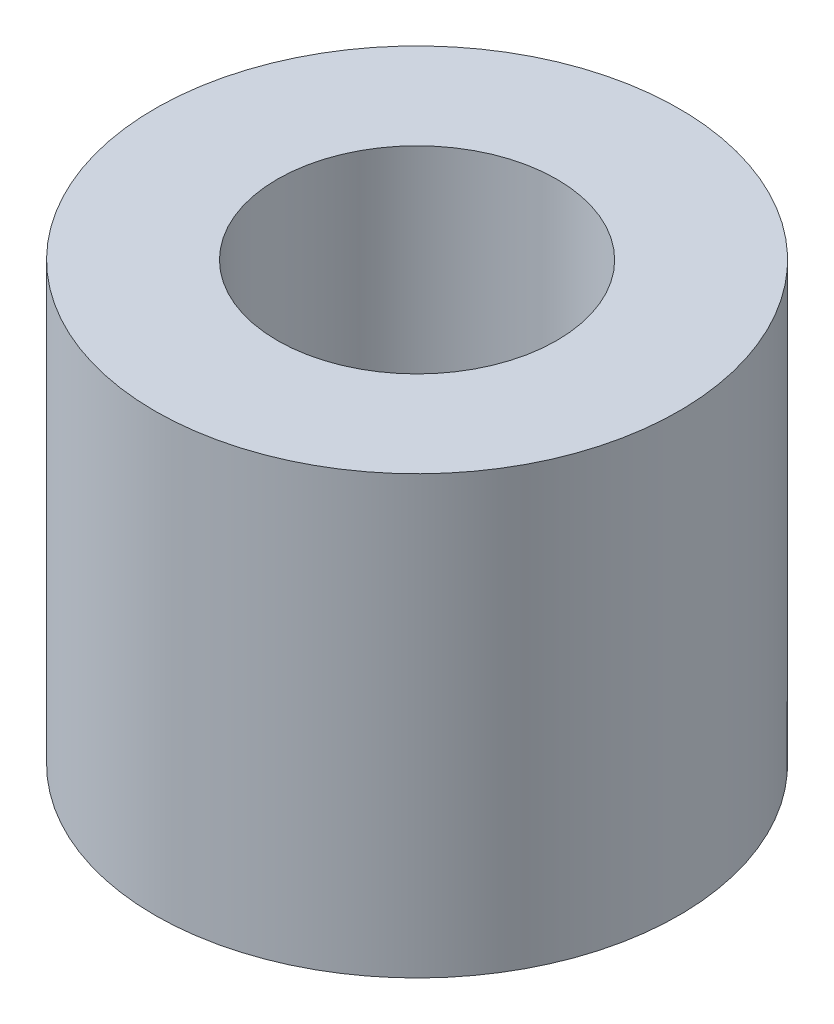
from build123d import *

# Parameters (mm, degrees)
SKETCH1_R           = 3
SKETCH1_R_2         = 1.6
BOSS_EXTRUDE1_DEPTH = 5


with BuildPart() as part:
    # Sketch1 → Boss-Extrude1 (new body)
    with BuildSketch(Plane(origin=(0, 0, 0), x_dir=(1, 0, 0), z_dir=(0, 1, 0))):
        with Locations(Location((0, 0, 0), (0, 0, 270))):
            Circle(SKETCH1_R)
        with Locations(Location((0, 0, 0), (0, 0, 270))):
            Circle(SKETCH1_R_2, mode=Mode.SUBTRACT)
    extrude(amount=BOSS_EXTRUDE1_DEPTH)


solid = part.part
